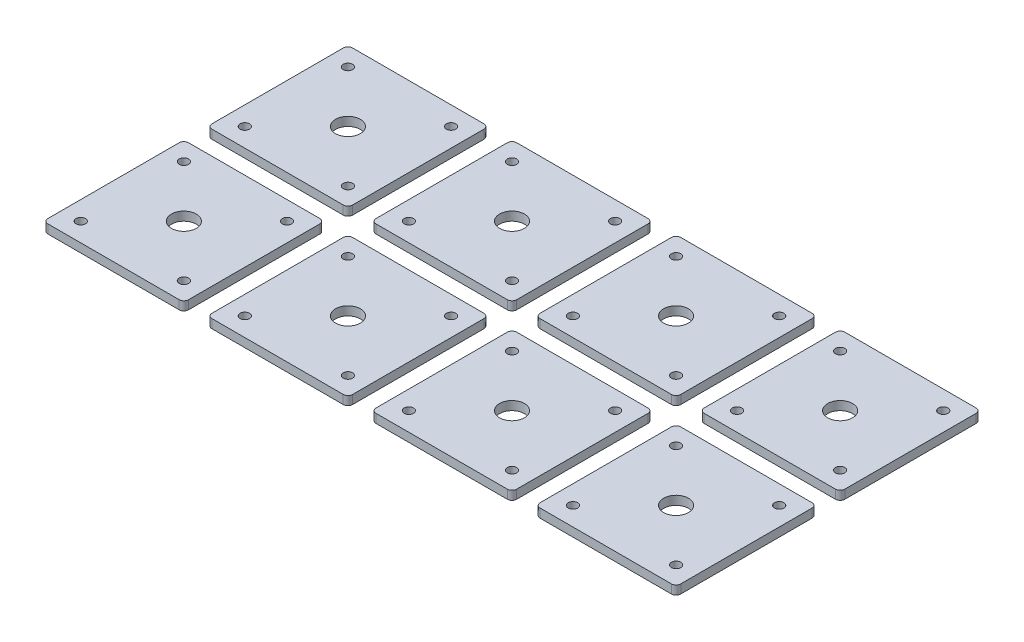
from build123d import *

# Parameters (mm, degrees)
SKETCH2_W           = 38.1
SKETCH2_H           = 38.1
SKETCH2_R           = 1.27
SKETCH2_R_2         = 3.3655
BOSS_EXTRUDE1_DEPTH = 2.38125
FILLET1_R           = 1.27
LPATTERN1_COUNT     = 2
LPATTERN1_PITCH     = 44.45
LPATTERN1_2_COUNT   = 4
LPATTERN1_2_PITCH   = 44.45


with BuildPart() as part:
    # Sketch2 → Boss-Extrude1 (new body)
    with BuildSketch(Plane(origin=(0, 0, 0), x_dir=(1, 0, 0), z_dir=(0, 1, 0))):
        Rectangle(SKETCH2_W, SKETCH2_H)
        with Locations(Location((-13.97, 13.97, 0), (0, 0, 90))):
            Circle(SKETCH2_R, mode=Mode.SUBTRACT)
        with Locations(Location((-13.97, -13.97, 0), (0, 0, 90))):
            Circle(SKETCH2_R, mode=Mode.SUBTRACT)
        with Locations(Location((13.97, -13.97, 0), (0, 0, 90))):
            Circle(SKETCH2_R, mode=Mode.SUBTRACT)
        with Locations(Location((13.97, 13.97, 0), (0, 0, 90))):
            Circle(SKETCH2_R, mode=Mode.SUBTRACT)
        with Locations(Location((0, 0, 0), (0, 0, 90))):
            Circle(SKETCH2_R_2, mode=Mode.SUBTRACT)
    extrude(amount=BOSS_EXTRUDE1_DEPTH)

    # Fillet1
    fillet1_edges = [part.edges().sort_by_distance(p)[0] for p in [
        (19.05, 1.190625, 19.05),
        (-19.05, 1.190625, 19.05),
        (-19.05, 1.190625, -19.05),
        (19.05, 1.190625, -19.05),
    ]]
    fillet(fillet1_edges, radius=FILLET1_R)


with BuildPart() as lpattern1_1:
    # LPattern1: pattern copy
    add(part.part.moved(Location(Vector(0, 0, 1) * (1 * LPATTERN1_PITCH))))


with BuildPart() as lpattern1_2_1:
    # LPattern1 2: pattern copy
    add(part.part.moved(Location(Vector(1, 0, 0) * (1 * LPATTERN1_2_PITCH))))


with BuildPart() as lpattern1_2_2:
    # LPattern1 2: pattern copy
    add(part.part.moved(Location(Vector(1, 0, 0) * (2 * LPATTERN1_2_PITCH))))


with BuildPart() as lpattern1_2_3:
    # LPattern1 2: pattern copy
    add(part.part.moved(Location(Vector(1, 0, 0) * (3 * LPATTERN1_2_PITCH))))


with BuildPart() as lpattern1_2_4:
    # LPattern1 2: pattern copy
    add(lpattern1_1.part.moved(Location(Vector(1, 0, 0) * (1 * LPATTERN1_2_PITCH))))


with BuildPart() as lpattern1_2_5:
    # LPattern1 2: pattern copy
    add(lpattern1_1.part.moved(Location(Vector(1, 0, 0) * (2 * LPATTERN1_2_PITCH))))


with BuildPart() as lpattern1_2_6:
    # LPattern1 2: pattern copy
    add(lpattern1_1.part.moved(Location(Vector(1, 0, 0) * (3 * LPATTERN1_2_PITCH))))


solid = Compound([part.part, lpattern1_1.part, lpattern1_2_1.part, lpattern1_2_2.part, lpattern1_2_3.part, lpattern1_2_4.part, lpattern1_2_5.part, lpattern1_2_6.part])
